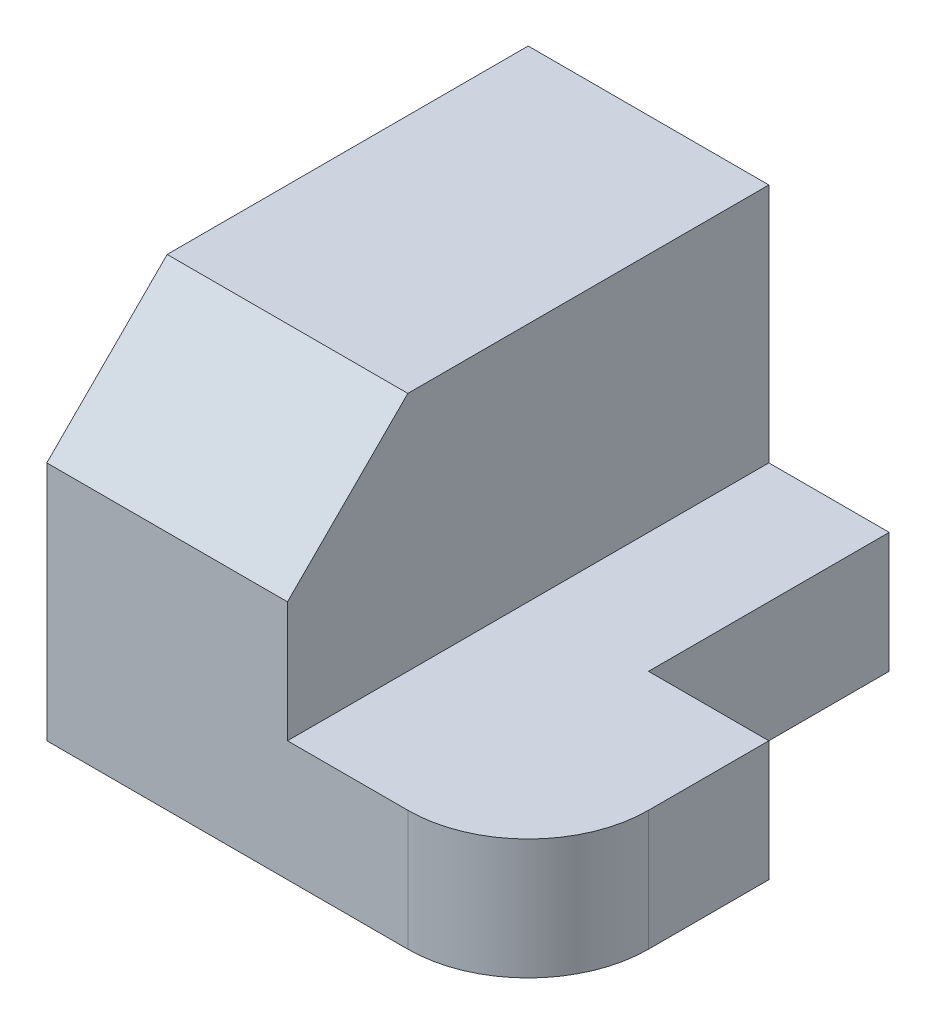
from build123d import *

# Parameters (mm, degrees)
SKETCH_1_W      = 20
SKETCH_1_H      = 10
EXTRUDE_1_DEPTH = 20
EXTRUDE_2_DEPTH = 10
SKETCH_1_4_W    = 20
SKETCH_1_4_H    = 30
EXTRUDE_3_DEPTH = 30
EXTRUDE_4_DEPTH = 20
FILLET_1_R      = 10


with BuildPart() as part:
    # 草圖1 → 填料-伸長1 (new body)
    with BuildSketch(Plane(origin=(0, 0, 0), x_dir=(1, 0, 0), z_dir=(0, 1, 0))):
        with Locations((-10, 5)):
            Rectangle(SKETCH_1_W, SKETCH_1_H)
    extrude(amount=EXTRUDE_1_DEPTH)

    # 草圖1<3> → 填料-伸長2 (add)
    with BuildSketch(Plane(origin=(0, 0, 0), x_dir=(1, 0, 0), z_dir=(0, 1, 0))):
        Polygon((0, 10), (0, 0), (20, 0), (20, 20), (10, 20), (10, 40), (0, 40), align=None)
    extrude(amount=EXTRUDE_2_DEPTH)

    # 草圖1<4> → 填料-伸長3 (add)
    with BuildSketch(Plane(origin=(0, 0, 0), x_dir=(1, 0, 0), z_dir=(0, 1, 0))):
        with Locations((-10, 25)):
            Rectangle(SKETCH_1_4_W, SKETCH_1_4_H)
    extrude(amount=EXTRUDE_3_DEPTH)

    # 草圖2 → 填料-伸長4 (add)
    with BuildSketch(Plane(origin=(0, 0, 0), x_dir=(0, 0, -1), z_dir=(1, 0, 0))):
        Polygon((10, 30), (0, 20), (10, 20), align=None)
    extrude(amount=-EXTRUDE_4_DEPTH)

    # 圓角1
    fillet_1_edges = [part.edges().sort_by_distance(p)[0] for p in [
        (20, 5, 0),
    ]]
    fillet(fillet_1_edges, radius=FILLET_1_R)


solid = part.part
